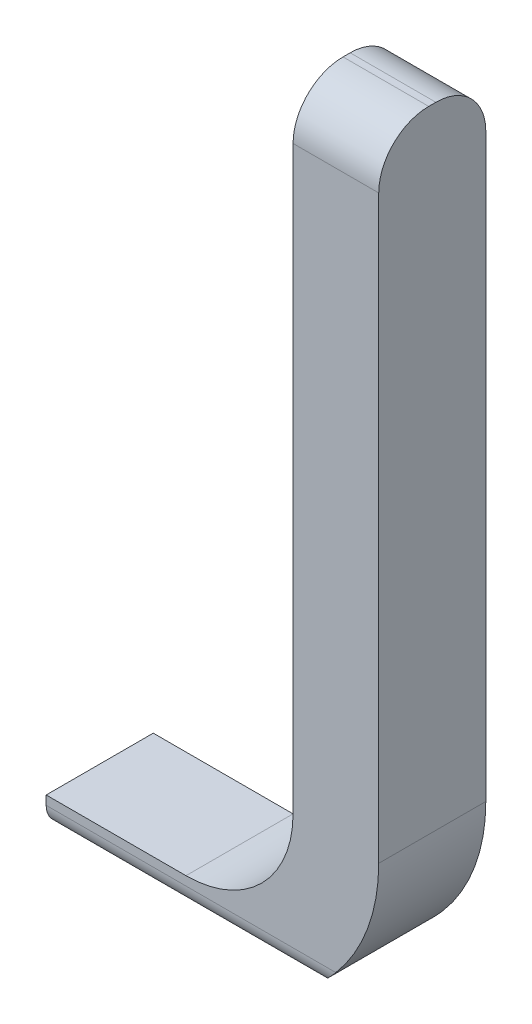
from build123d import *

# Parameters (mm, degrees)
BOSS_EXTRUDE1_DEPTH = 15
FILLET1_R           = 7
CUT_EXTRUDE1_DEPTH  = 46.581927456
FILLET2_R           = 3


with BuildPart() as part:
    # Sketch1 → Boss-Extrude1 (new body)
    with BuildSketch(Plane.XY):
        with BuildLine():
            Line((81.814228499, 422.253610621), (101.396155955, 422.253610621))
            ThreePointArc((101.396155955, 422.253610621), (112.002757673, 426.647008903), (116.396155955, 437.253610621))
            Line((116.396155955, 437.253610621), (116.396155955, 525.576232013))
            Line((116.396155955, 525.576232013), (128.396155955, 525.576232013))
            Line((128.396155955, 525.576232013), (128.396155955, 437.253610621))
            ThreePointArc((128.396155955, 437.253610621), (121.073825485, 419.575941091), (103.396155955, 412.253610621))
            Line((103.396155955, 412.253610621), (81.814228499, 412.253610621))
            Line((81.814228499, 412.253610621), (81.814228499, 422.253610621))
        make_face()
    extrude(amount=-BOSS_EXTRUDE1_DEPTH)

    # Fillet1
    fillet1_edges = [part.edges().sort_by_distance(p)[0] for p in [
        (122.396155955, 525.576232013, -15),
        (122.396155955, 525.576232013, 0),
    ]]
    fillet(fillet1_edges, radius=FILLET1_R)

    # Sketch2 → Cut-Extrude1 (cut)
    with BuildSketch(Plane(origin=(128.396155955, 0, 0), x_dir=(0, 0, -1), z_dir=(1, 0, 0))):
        Polygon((0, 419.753610621), (7.5, 412.253610621), (15, 419.753610621), (15, 408.691340296), (0, 408.691340296), align=None)
    extrude(amount=-CUT_EXTRUDE1_DEPTH, mode=Mode.SUBTRACT)

    # Fillet2
    fillet2_edges = [part.edges().sort_by_distance(p)[0] for p in [
        (101.531977763, 419.753610621, -15),
        (101.531977763, 419.753610621, 0),
    ]]
    fillet(fillet2_edges, radius=FILLET2_R)


solid = part.part
